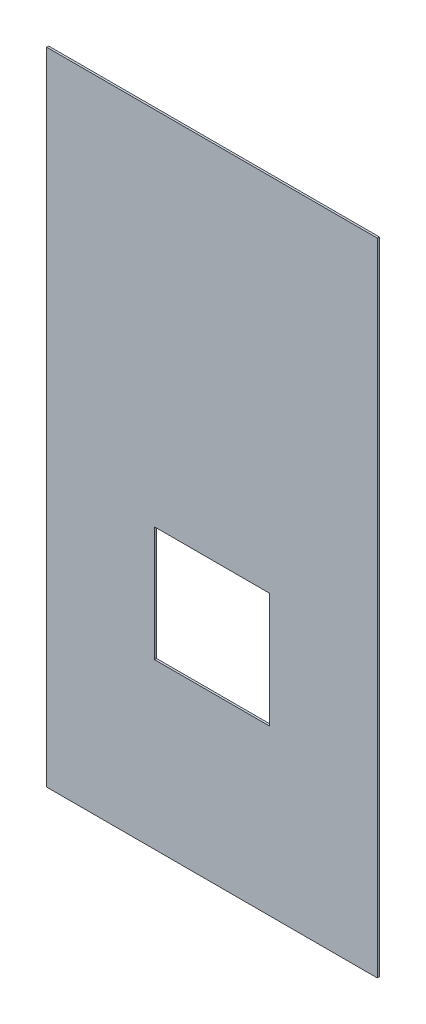
from build123d import *

# Parameters (mm, degrees)
SKETCH1_W           = 1022.35
SKETCH1_H           = 1981.2
SKETCH1_W_2         = 355.6
SKETCH1_H_2         = 355.6
BOSS_EXTRUDE1_DEPTH = 6.35


with BuildPart() as part:
    # Sketch1 → Boss-Extrude1 (new body)
    with BuildSketch(Plane.XY):
        with Locations((511.175, 990.6)):
            Rectangle(SKETCH1_W, SKETCH1_H)
        with Locations((511.048, 685.8)):
            Rectangle(SKETCH1_W_2, SKETCH1_H_2, mode=Mode.SUBTRACT)
    extrude(amount=BOSS_EXTRUDE1_DEPTH)


solid = part.part
